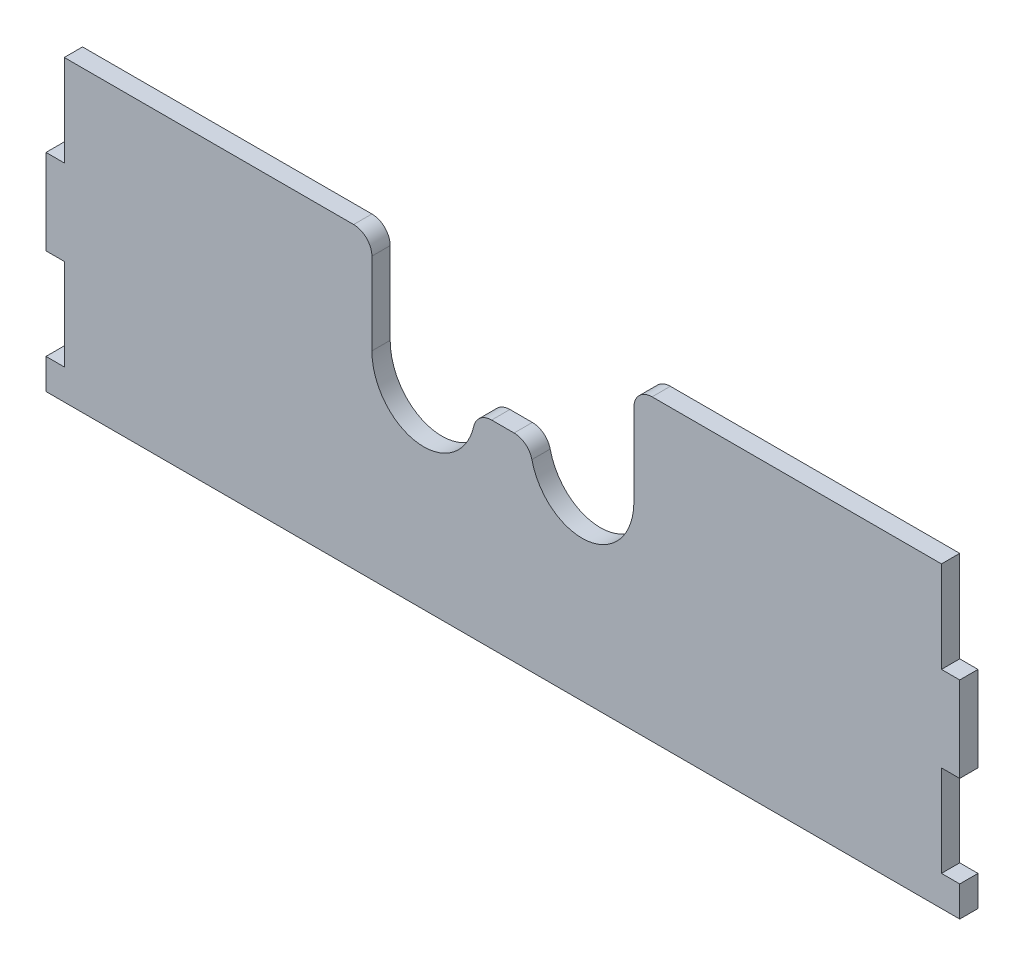
from build123d import *

# Parameters (mm, degrees)
SALIENTE_EXTRUIR1_DEPTH = 3
CROQUIS2_R              = 8.5
CORTAR_EXTRUIR1_DEPTH   = 81.972978651
CROQUIS3_RX             = 9.378712311
CROQUIS3_RY             = 8.5
CORTAR_EXTRUIR2_DEPTH   = 3
CROQUIS4_W              = 43
CROQUIS4_H              = 16.468521704
CORTAR_EXTRUIR3_DEPTH   = 80.113842029
REDONDEO1_R             = 3
CROQUIS5_W              = 150
CROQUIS5_H              = 1
CORTAR_EXTRUIR4_DEPTH   = 80.113842155


with BuildPart() as part:
    # Croquis1 → Saliente-Extruir1 (new body)
    with BuildSketch(Plane.XY):
        Polygon((-75, -19), (-75, -25), (75, -25), (75, -19), (72, -19), (72, -4), (75, -4), (75, 10), (72, 10), (72, 25), (-72, 25), (-72, 10), (-75, 10), (-75, -4), (-72, -4), (-72, -19), align=None)
    extrude(amount=SALIENTE_EXTRUIR1_DEPTH)

    # Croquis2 → Cortar-Extruir1 (cut, through all)
    with BuildSketch(Plane(origin=(0, 2.342305324, -10.565456544), x_dir=(1, 0, 0), z_dir=(0, -0.4226182617407, 0.9063077870366497))):
        with Locations(Location((-13, 11.342305324, 0), (0, 0, 90))):
            Circle(CROQUIS2_R)
        with Locations(Location((13, 11.342305324, 0), (0, 0, 90))):
            Circle(CROQUIS2_R)
    extrude(amount=CORTAR_EXTRUIR1_DEPTH, mode=Mode.SUBTRACT)

    # Croquis3 → Cortar-Extruir2 (cut)
    with BuildSketch(Plane.XY):
        with Locations(Location((-13, 8.531478296), (0, 0, 90))):
            Ellipse(CROQUIS3_RX, CROQUIS3_RY)
        with Locations(Location((-13, 9.930401271), (0, 0, 90))):
            Ellipse(CROQUIS3_RX, CROQUIS3_RY)
        with Locations(Location((-13, 9.930401271), (0, 0, 90))):
            Ellipse(CROQUIS3_RX, CROQUIS3_RY)
        with Locations(Location((-13, 8.531478296), (0, 0, 90))):
            Ellipse(CROQUIS3_RX, CROQUIS3_RY)
        with Locations(Location((13, 9.930401271), (0, 0, 90))):
            Ellipse(CROQUIS3_RX, CROQUIS3_RY)
        with Locations(Location((13, 8.531478296), (0, 0, 90))):
            Ellipse(CROQUIS3_RX, CROQUIS3_RY)
        with Locations(Location((13, 8.531478296), (0, 0, 90))):
            Ellipse(CROQUIS3_RX, CROQUIS3_RY)
        with Locations(Location((13, 9.930401271), (0, 0, 90))):
            Ellipse(CROQUIS3_RX, CROQUIS3_RY)
        with Locations(Location((13, 8.531478296), (0, 0, 90))):
            Ellipse(CROQUIS3_RX, CROQUIS3_RY)
        with Locations(Location((13, 9.930401271), (0, 0, 90))):
            Ellipse(CROQUIS3_RX, CROQUIS3_RY)
        with Locations(Location((-13, 8.531478296), (0, 0, 90))):
            Ellipse(CROQUIS3_RX, CROQUIS3_RY)
        with Locations(Location((-13, 9.930401271), (0, 0, 90))):
            Ellipse(CROQUIS3_RX, CROQUIS3_RY)
    extrude(amount=CORTAR_EXTRUIR2_DEPTH, mode=Mode.SUBTRACT)

    # Croquis4 → Cortar-Extruir3 (cut, through all)
    with BuildSketch(Plane.XY):
        with Locations((0, 16.765739148)):
            Rectangle(CROQUIS4_W, CROQUIS4_H)
    extrude(amount=CORTAR_EXTRUIR3_DEPTH, mode=Mode.SUBTRACT)

    # Redondeo1
    redondeo1_edges = [part.edges().sort_by_distance(p)[0] for p in [
        (4.5, 8.531478296, 1.5000003),
        (-4.5, 8.531478296, 1.5000003),
        (21.5, 25, 1.5),
        (-21.5, 25, 1.5),
    ]]
    fillet(redondeo1_edges, radius=REDONDEO1_R)

    # Croquis5 → Cortar-Extruir4 (cut, through all)
    with BuildSketch(Plane.XY):
        with Locations((0, -24.5)):
            Rectangle(CROQUIS5_W, CROQUIS5_H)
    extrude(amount=CORTAR_EXTRUIR4_DEPTH, mode=Mode.SUBTRACT)


solid = part.part
